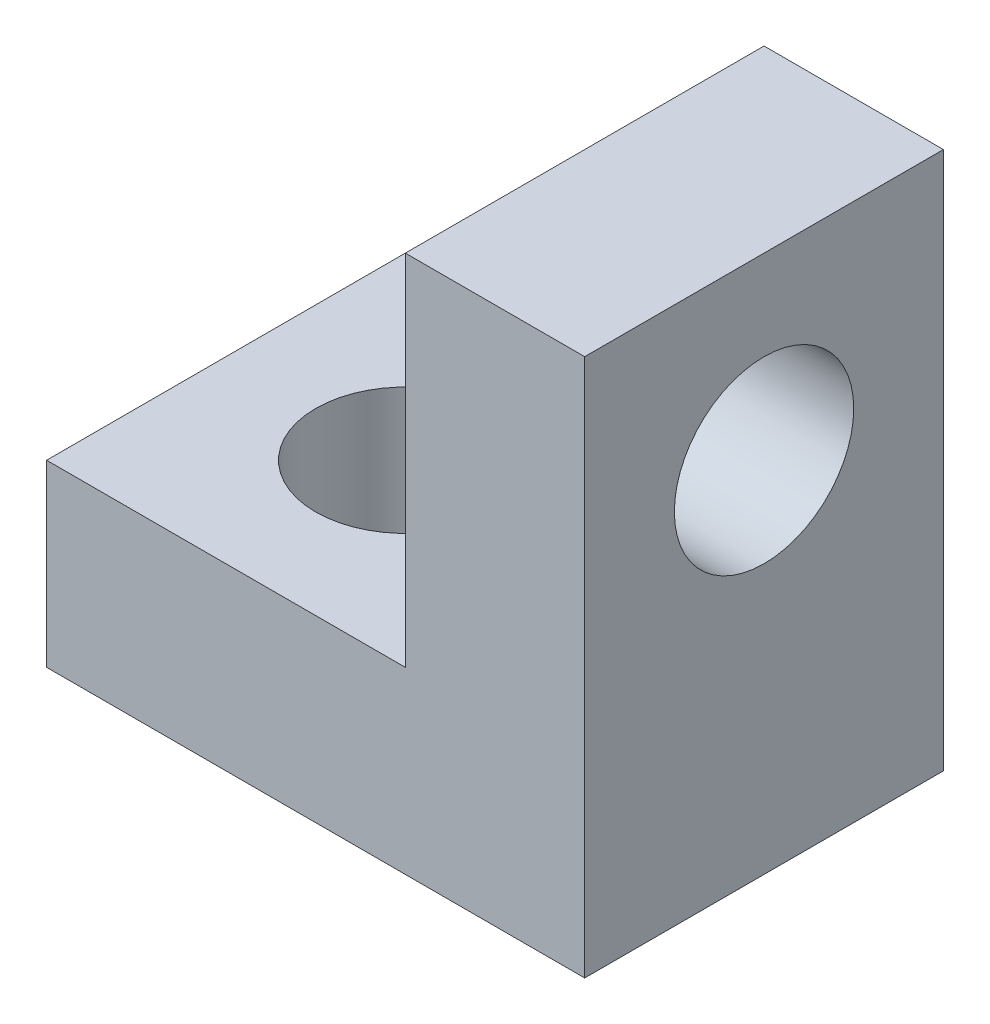
from build123d import *

# Parameters (mm, degrees)
BOSS_EXTRUDE1_DEPTH = 10
SKETCH4_R           = 2.5
CUT_EXTRUDE1_DEPTH  = 5
SKETCH5_R           = 2.5
CUT_EXTRUDE2_DEPTH  = 5


with BuildPart() as part:
    # 3DSketch1 → Boss-Extrude1 (new body)
    with BuildSketch(Plane(origin=(0, 0, 0), x_dir=(0.8320502943378437, 0.554700196225229, 0), z_dir=(0, 0, -1))):
        Polygon((0, 0), (8.320502943, 5.547001962), (13.867504906, -2.773500981), (18.027756377, 0), (9.707253434, 12.480754415), (-2.773500981, 4.160251472), align=None)
    extrude(amount=-BOSS_EXTRUDE1_DEPTH)

    # Sketch4 → Cut-Extrude1 (cut)
    with BuildSketch(Plane.ZY.offset(-10)):
        with Locations((5, 5)):
            Circle(SKETCH4_R)
    extrude(amount=-CUT_EXTRUDE1_DEPTH, mode=Mode.SUBTRACT)

    # Sketch5 → Cut-Extrude2 (cut)
    with BuildSketch(Plane(origin=(0, 0, 0), x_dir=(1, 0, 0), z_dir=(0, 1, 0))):
        with Locations(Location((5, -5, 0), (0, 0, 270))):
            Circle(SKETCH5_R)
    extrude(amount=-CUT_EXTRUDE2_DEPTH, mode=Mode.SUBTRACT)


solid = part.part
